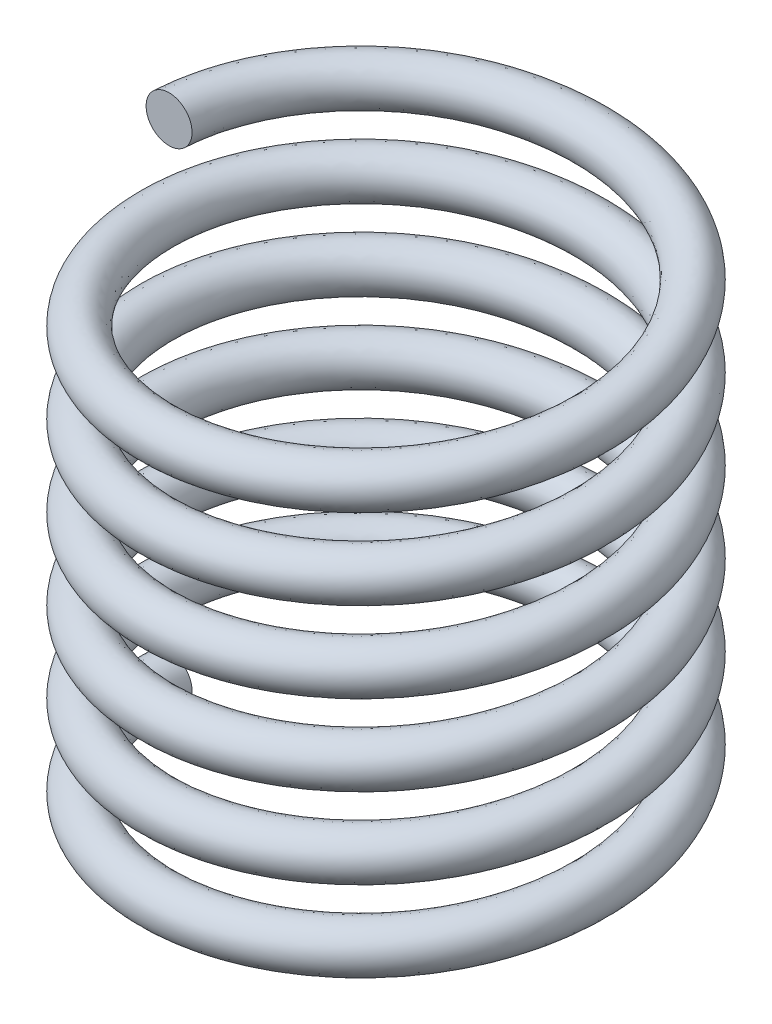
from build123d import *

# Parameters (mm, degrees)
SWEEP1_PITCH       = 1.113366667
SWEEP1_HEIGHT      = 6.6802
SWEEP1_RADIUS      = 2.9972
SWEEP1_START_ANGLE = -90
SKETCH2_R          = 0.3175


with BuildPart() as part:
    # Sweep1: sweep along a helix
    with BuildLine() as sweep1_path:
        add(Helix(SWEEP1_PITCH, SWEEP1_HEIGHT, SWEEP1_RADIUS, center=(0, 0, 0), direction=(0, 1, 0), mode=Mode.PRIVATE).rotate(Axis((0, 0, 0), (0, 1, 0)), SWEEP1_START_ANGLE))
    # Sketch2 → Sweep1 (sweep)
    with BuildSketch(Plane.XY):
        with Locations((-2.9972, 0)):
            Circle(SKETCH2_R)
    sweep(path=sweep1_path.line, is_frenet=True)


solid = part.part
